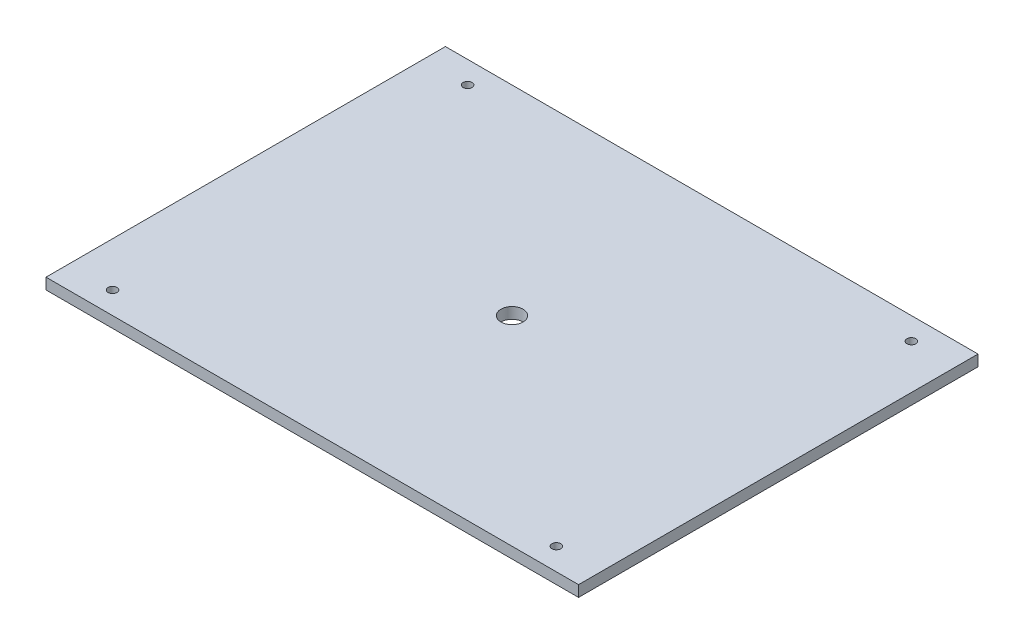
from build123d import *

# Parameters (mm, degrees)
SKETCH1_W           = 240
SKETCH1_H           = 180
SKETCH1_R           = 2
SKETCH1_R_2         = 5
BOSS_EXTRUDE1_DEPTH = 5


with BuildPart() as part:
    # Sketch1 → Boss-Extrude1 (new body)
    with BuildSketch(Plane(origin=(0, 0, 0), x_dir=(1, 0, 0), z_dir=(0, 1, 0))):
        Rectangle(SKETCH1_W, SKETCH1_H)
        with Locations(Location((-100, 80, 0), (0, 0, 270))):
            Circle(SKETCH1_R, mode=Mode.SUBTRACT)
        with Locations(Location((100, 80, 0), (0, 0, 270))):
            Circle(SKETCH1_R, mode=Mode.SUBTRACT)
        with Locations(Location((100, -80, 0), (0, 0, 270))):
            Circle(SKETCH1_R, mode=Mode.SUBTRACT)
        with Locations(Location((-100, -80, 0), (0, 0, 270))):
            Circle(SKETCH1_R, mode=Mode.SUBTRACT)
        with Locations(Location((0, 0, 0), (0, 0, 270))):
            Circle(SKETCH1_R_2, mode=Mode.SUBTRACT)
    extrude(amount=BOSS_EXTRUDE1_DEPTH)


solid = part.part
